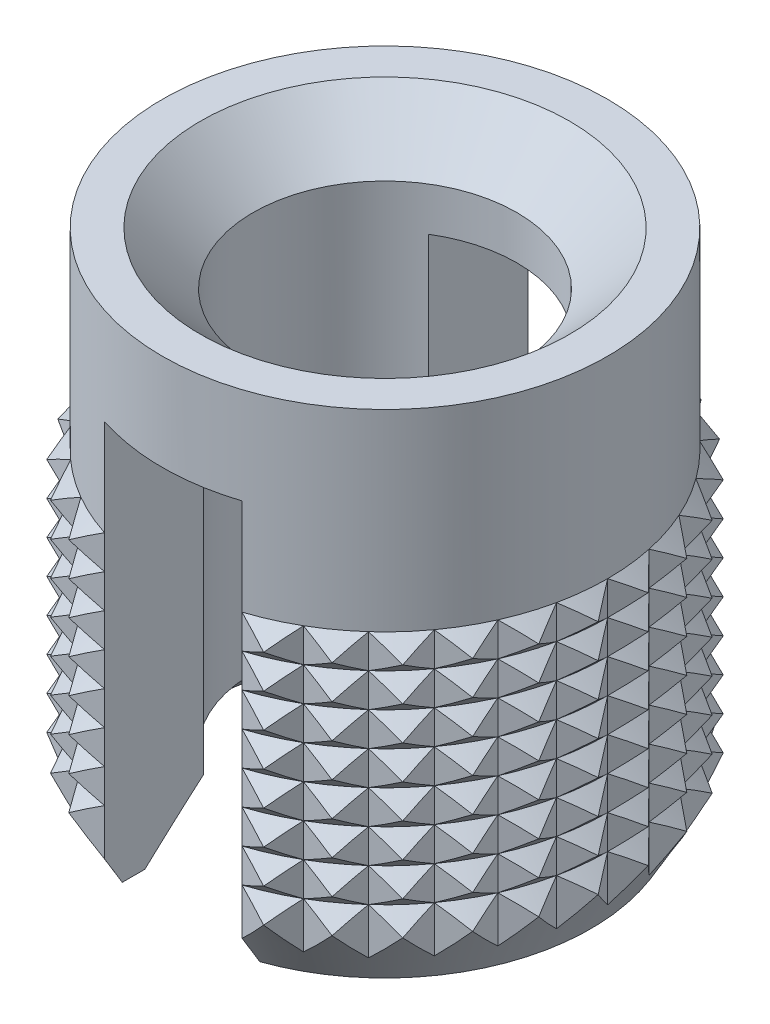
from build123d import *

# Parameters (mm, degrees)
CUT_EXTRUDE1_DEPTH      = 6.757968392
CIRPATTERN1_COUNT       = 30
CUT_EXTRUDE2_DEPTH      = 6.753077297
CUT_EXTRUDE2_DEPTH_BACK = 6.753077297


with BuildPart() as part:
    # Sketch2 → Revolve1 (revolve)
    with BuildSketch(Plane.XY, mode=Mode.PRIVATE) as revolve1_sk:
        Polygon((-2.11, 4.78), (-2.11, 2.954256258), (-2.27, 2.794256258), (-2.11, 2.634256258), (-2.27, 2.474256258), (-2.11, 2.314256258), (-2.27, 2.154256258), (-2.11, 1.994256258), (-2.27, 1.834256258), (-2.11, 1.674256258), (-2.27, 1.514256258), (-2.11, 1.354256258), (-2.27, 1.194256258), (-2.11, 1.034256258), (-2.27, 0.874256258), (-2.11, 0.714256258), (-2.27, 0.554256258), (-1.95, 0), (-1.75, 0), (-1.25, 0.5), (-1.25, 4.28), (-1.75, 4.78), align=None)
    revolve(revolve1_sk.sketch.rotate(Axis((0, 0, 0), (0, 1, 0)), 270), axis=Axis((0, 0, 0), (0, 1, 0)))

    # Sketch3 → Cut-Extrude1 (cut, symmetric)
    with BuildSketch(Plane(origin=(0, 4.78, 0), x_dir=(1, 0, 0), z_dir=(0, 1, 0))):
        Polygon((-0.220555057, 2.098441199), (0, 2.27), (0.220555057, 2.098441199), (0.289151629, 2.751093985), (-0.289151629, 2.751093985), align=None)
    cut_extrude1 = extrude(amount=CUT_EXTRUDE1_DEPTH, both=True, mode=Mode.SUBTRACT)

    # CirPattern1: Cut-Extrude1 ×30 about axis
    cirpattern1_axis = Axis((0, 0, 0), (0, 1, 0))
    for i in range(1, CIRPATTERN1_COUNT):
        add(cut_extrude1.rotate(cirpattern1_axis, i * 360 / CIRPATTERN1_COUNT), mode=Mode.SUBTRACT)

    # Sketch4 → Cut-Extrude2 (cut, two sides: drawn at the far end of the back side and taken through both)
    with BuildSketch(Plane.XY.offset(-CUT_EXTRUDE2_DEPTH_BACK)):
        Polygon((-0.652025858, 3.867128129), (0.652025858, 3.867128129), (0.652025858, 2.954256258), (0.652025858, 0), (-0.652025858, 0), align=None)
    extrude(amount=CUT_EXTRUDE2_DEPTH + CUT_EXTRUDE2_DEPTH_BACK, mode=Mode.SUBTRACT)


solid = part.part
